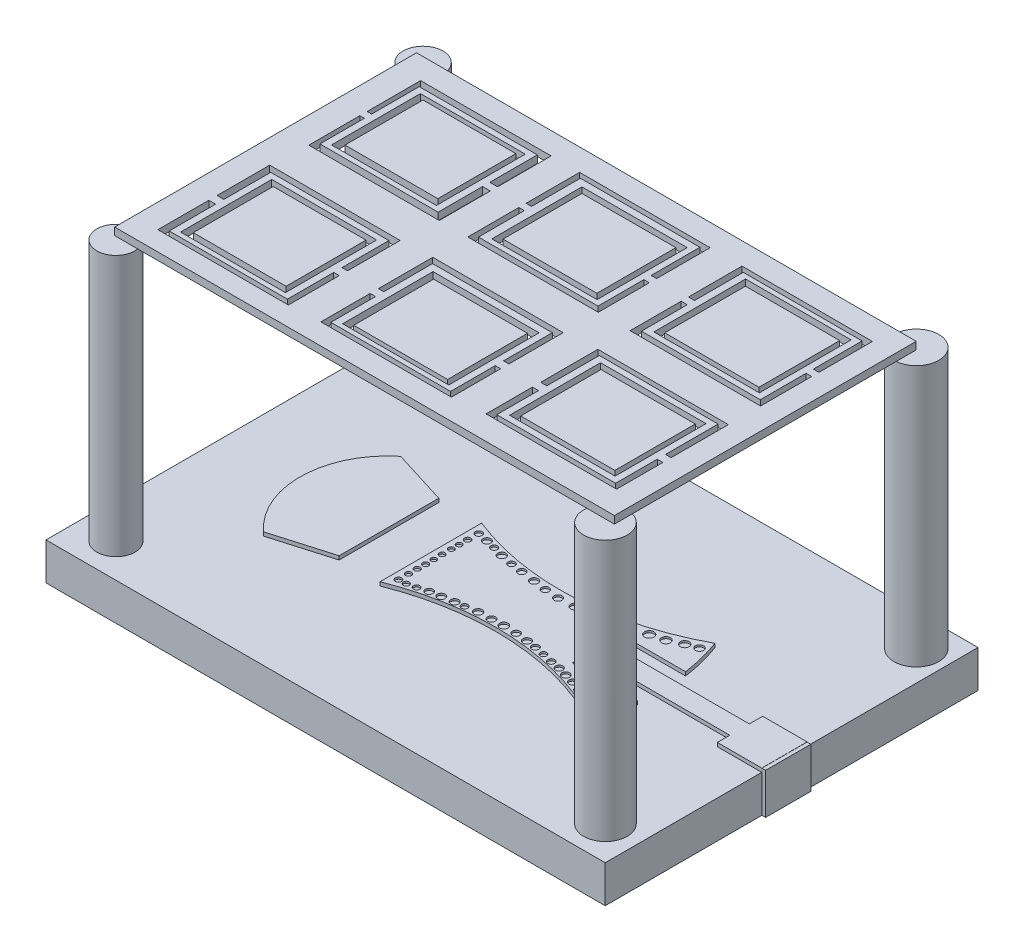
from build123d import *

# Parameters (mm, degrees)
SKETCH1_W           = 15
SKETCH1_H           = 10
BOSS_EXTRUDE1_DEPTH = 1
BOSS_EXTRUDE3_DEPTH = 0.1
SKETCH4_R           = 0.08404807
SKETCH4_R_2         = 0.078648597
SKETCH4_R_3         = 0.079112573
SKETCH4_R_4         = 0.079168928
SKETCH4_R_5         = 0.073492336
SKETCH4_R_6         = 0.076907287
SKETCH4_R_7         = 0.076143431
SKETCH4_R_8         = 0.075473783
SKETCH4_R_9         = 0.081679899
SKETCH4_R_10        = 0.091446078
SKETCH4_R_11        = 0.080118839
SKETCH4_R_12        = 0.08382722
SKETCH4_R_13        = 0.101692564
SKETCH4_R_14        = 0.104017769
SKETCH4_R_15        = 0.104305519
SKETCH4_R_16        = 0.087623359
SKETCH4_R_17        = 0.109373187
SKETCH4_R_18        = 0.103421713
SKETCH4_R_19        = 0.112137735
SKETCH4_R_20        = 0.099980842
SKETCH4_R_21        = 0.106432835
SKETCH4_R_22        = 0.095496829
SKETCH4_R_23        = 0.083167495
SKETCH4_R_24        = 0.091862706
SKETCH4_R_25        = 0.099164907
SKETCH4_R_26        = 0.096133792
SKETCH4_R_27        = 0.107488504
SKETCH4_R_28        = 0.108039655
SKETCH4_R_29        = 0.11284557
SKETCH4_R_30        = 0.105833191
SKETCH4_R_31        = 0.087500941
SKETCH4_R_32        = 0.108184079
SKETCH4_R_33        = 0.091887578
SKETCH4_R_34        = 0.101590536
SKETCH4_R_35        = 0.10874326
SKETCH4_R_36        = 0.099896252
SKETCH4_R_37        = 0.105411216
SKETCH4_R_38        = 0.110092368
SKETCH4_R_39        = 0.111538179
SKETCH4_R_40        = 0.119518934
SKETCH4_R_41        = 0.117282428
SKETCH4_R_42        = 0.124998957
SKETCH4_R_43        = 0.119568335
SKETCH4_R_44        = 0.117616461
SKETCH4_R_45        = 0.109204459
SKETCH4_R_46        = 0.113389559
SKETCH4_R_47        = 0.103967849
CUT_EXTRUDE1_DEPTH  = 0.05
SKETCH7_R           = 0.511988864
SKETCH7_R_2         = 0.53656798
SKETCH7_R_3         = 0.584547728
SKETCH7_R_4         = 0.601410947
BOSS_EXTRUDE4_DEPTH = 7
SKETCH8_W           = 13.404868806
SKETCH8_H           = 8.095482793
BOSS_EXTRUDE5_DEPTH = 0.2
SKETCH9_W           = 2.813790515
SKETCH9_H           = 2.446731184
SKETCH9_W_2         = 2.489913923
SKETCH9_H_2         = 2.143373666
SKETCH9_H_3         = 2.384007885
SKETCH9_H_4         = 2.092857043
SKETCH9_W_3         = 2.845584972
SKETCH9_H_5         = 2.424945468
SKETCH9_W_4         = 2.517381772
SKETCH9_W_5         = 2.822228556
SKETCH9_H_6         = 2.417634942
SKETCH9_H_7         = 2.11773717
SKETCH9_W_6         = 2.830214289
SKETCH9_H_8         = 2.440413026
SKETCH9_W_7         = 2.527654553
SKETCH9_H_9         = 2.157221543
SKETCH9_H_10        = 2.460253307
SKETCH9_H_11        = 2.166211349
CUT_EXTRUDE4_DEPTH  = 2
SKETCH11_W          = 1.211385537
SKETCH11_H          = 1.095339331
BOSS_EXTRUDE6_DEPTH = 0.1


with BuildPart() as part:
    # Sketch1 → Boss-Extrude1 (new body)
    with BuildSketch(Plane(origin=(0, 0, 0), x_dir=(1, 0, 0), z_dir=(0, 1, 0))):
        with Locations((-3.087083516, -10.30646302)):
            Rectangle(SKETCH1_W, SKETCH1_H)
    extrude(amount=BOSS_EXTRUDE1_DEPTH)

    # Sketch2 → Boss-Extrude3 (add)
    with BuildSketch(Plane(origin=(0, 1, 0), x_dir=(1, 0, 0), z_dir=(0, 1, 0))):
        with BuildLine():
            Line((-7.754263874, -12.300690078), (-6.187338637, -11.842809111))
            Line((-6.187338637, -11.842809111), (-6.187338637, -9.170838767))
            Line((-6.187338637, -9.170838767), (-7.671339357, -8.708437744))
            ThreePointArc((-7.671339357, -8.708437744), (-8.543841662, -10.48537996), (-7.754263874, -12.300690078))
        make_face()
        with BuildLine():
            Line((-5.034800823, -9.173433417), (-5.034800823, -11.898013395))
            ThreePointArc((-5.034800823, -11.898013395), (-1.990708873, -11.415844317), (0.969425609, -12.27409059))
            ThreePointArc((0.969425609, -12.27409059), (1.104540684, -11.745809691), (1.185652096, -11.206590133))
            Line((1.185652096, -11.206590133), (-0.573658049, -11.206590133))
            Line((-0.573658049, -11.206590133), (-0.573658049, -10.773444218))
            Line((-0.573658049, -10.773444218), (3.221463254, -10.773444218))
            Line((3.221463254, -10.773444218), (3.221463254, -11.107047597))
            Line((3.221463254, -11.107047597), (4.412916484, -11.107047597))
            Line((4.412916484, -11.107047597), (4.412916484, -9.890890727))
            Line((4.412916484, -9.890890727), (3.221463254, -9.890890727))
            Line((3.221463254, -9.890890727), (3.221463254, -10.248768016))
            Line((3.221463254, -10.248768016), (-0.573658049, -10.248768016))
            Line((-0.573658049, -10.248768016), (-0.573658049, -9.890890727))
            Line((-0.573658049, -9.890890727), (1.154743997, -9.890890727))
            ThreePointArc((1.154743997, -9.890890727), (1.048589239, -9.35681973), (0.889152381, -8.836165764))
            ThreePointArc((0.889152381, -8.836165764), (-2.035287154, -9.66412112), (-5.034800823, -9.173433417))
        make_face()
    extrude(amount=BOSS_EXTRUDE3_DEPTH)

    # Sketch4 → Cut-Extrude1 (cut)
    with BuildSketch(Plane(origin=(0, 1.1, 0), x_dir=(1, 0, 0), z_dir=(0, 1, 0))):
        with Locations((-4.83666706, -11.602759609)):
            Circle(SKETCH4_R)
        with Locations((-4.83666706, -11.332342919)):
            Circle(SKETCH4_R_2)
        with Locations((-4.83666706, -11.100994462)):
            Circle(SKETCH4_R_3)
        with Locations((-4.830877887, -10.880983654)):
            Circle(SKETCH4_R_4)
        with Locations((-4.830877887, -10.660487196)):
            Circle(SKETCH4_R_5)
        with Locations((-4.83666706, -10.430279322)):
            Circle(SKETCH4_R_6)
        with Locations((-4.83666706, -10.18220917)):
            Circle(SKETCH4_R_7)
        with Locations((-4.836673, -9.974192205)):
            Circle(SKETCH4_R_8)
        with Locations((-4.83666706, -9.747325915)):
            Circle(SKETCH4_R_9)
        with Locations((-4.830877887, -9.455715111)):
            Circle(SKETCH4_R_10)
        with Locations((-4.637829339, -11.59143287)):
            Circle(SKETCH4_R_11)
        with Locations((-4.412213651, -11.539756692)):
            Circle(SKETCH4_R_12)
        with Locations((-4.15161441, -11.465001291)):
            Circle(SKETCH4_R_13)
        with Locations((-3.873304564, -11.416770173)):
            Circle(SKETCH4_R_14)
        with Locations((-3.568146448, -11.363924053)):
            Circle(SKETCH4_R_15)
        with Locations((-3.3301854, -11.334842991)):
            Circle(SKETCH4_R_16)
        with Locations((-3.01928832, -11.284947396)):
            Circle(SKETCH4_R_17)
        with Locations((-2.675126152, -11.269056066)):
            Circle(SKETCH4_R_18)
        with Locations((-2.357549224, -11.25637604)):
            Circle(SKETCH4_R_19)
        with Locations((-2.012003425, -11.269056066)):
            Circle(SKETCH4_R_20)
        with Locations((-1.689895211, -11.302778087)):
            Circle(SKETCH4_R_21)
        with Locations((-1.430792738, -11.334842991)):
            Circle(SKETCH4_R_22)
        with Locations((-1.160837501, -11.388654237)):
            Circle(SKETCH4_R_23)
        with Locations((-0.886084035, -11.455150599)):
            Circle(SKETCH4_R_24)
        with Locations((-0.627031556, -11.502330935)):
            Circle(SKETCH4_R_25)
        with Locations((-0.123988492, -11.646759979)):
            Circle(SKETCH4_R_26)
        with Locations((0.151484031, -11.740485043)):
            Circle(SKETCH4_R_27)
        with Locations((0.441194821, -11.875172635)):
            Circle(SKETCH4_R_28)
        with Locations((0.74912936, -12.010578122)):
            Circle(SKETCH4_R_29)
        with Locations((-4.549563888, -9.516257382)):
            Circle(SKETCH4_R_30)
        with Locations((-4.295883928, -9.576097395)):
            Circle(SKETCH4_R_31)
        with Locations((-4.012832927, -9.653574387)):
            Circle(SKETCH4_R_32)
        with Locations((-3.686948741, -9.72091873)):
            Circle(SKETCH4_R_33)
        with Locations((-3.372184134, -9.761383372)):
            Circle(SKETCH4_R_34)
        with Locations((-2.98678451, -9.812806308)):
            Circle(SKETCH4_R_35)
        with Locations((-2.636244668, -9.862973909)):
            Circle(SKETCH4_R_36)
        with Locations((-2.269336348, -9.890223739)):
            Circle(SKETCH4_R_37)
        with Locations((-1.847162344, -9.862973909)):
            Circle(SKETCH4_R_38)
        with Locations((-1.5343685, -9.842942516)):
            Circle(SKETCH4_R_39)
        with Locations((-0.951868155, -9.737895757)):
            Circle(SKETCH4_R_40)
        with Locations((-0.608529302, -9.663598336)):
            Circle(SKETCH4_R_41)
        with Locations((-0.20121135, -9.511532888)):
            Circle(SKETCH4_R_42)
        with Locations((0.158415834, -9.421234702)):
            Circle(SKETCH4_R_43)
        with Locations((0.503004379, -9.262251263)):
            Circle(SKETCH4_R_44)
        with Locations((0.791211489, -9.154940305)):
            Circle(SKETCH4_R_45)
        with Locations((-1.255509111, -9.80036179)):
            Circle(SKETCH4_R_46)
        with Locations((-0.376470274, -11.575235122)):
            Circle(SKETCH4_R_47)
    extrude(amount=-CUT_EXTRUDE1_DEPTH, mode=Mode.SUBTRACT)

    # Sketch7 → Boss-Extrude4 (add)
    with BuildSketch(Plane(origin=(0, 1, 0), x_dir=(1, 0, 0), z_dir=(0, 1, 0))):
        with Locations((-9.619469301, -14.398463654)):
            Circle(SKETCH7_R)
        with Locations((-9.619469301, -6.161151994)):
            Circle(SKETCH7_R_2)
        with Locations((3.511550626, -14.398463654)):
            Circle(SKETCH7_R_3)
        with Locations((3.613841518, -6.161151994)):
            Circle(SKETCH7_R_4)
    extrude(amount=BOSS_EXTRUDE4_DEPTH)

    # Sketch8 → Boss-Extrude5 (add)
    with BuildSketch(Plane(origin=(0, 8, 0), x_dir=(1, 0, 0), z_dir=(0, 1, 0))):
        with Locations((-3.031235406, -10.269605928)):
            Rectangle(SKETCH8_W, SKETCH8_H)
    extrude(amount=BOSS_EXTRUDE5_DEPTH)

    # Sketch9 → Cut-Extrude4 (cut)
    # profile 1 of 18: a face of its own
    with BuildSketch(Plane(origin=(0, 8.2, 0), x_dir=(1, 0, 0), z_dir=(0, 1, 0))):
        Polygon((-9.092726311, -12.433458539), (-8.911094854, -12.433458539), (-8.911094854, -13.676967395), (-5.741578039, -13.676967395), (-5.741578039, -12.433458539), (-5.592726311, -12.433458539), (-5.592726311, -13.800467421), (-9.092726311, -13.800467421), align=None)
    # profile 2 of 18: a face of its own
    with BuildSketch(Plane(origin=(0, 8.2, 0), x_dir=(1, 0, 0), z_dir=(0, 1, 0))):
        Polygon((-9.092726311, -10.800467421), (-5.592726311, -10.800467421), (-5.592726311, -12.211472668), (-5.741578039, -12.211472668), (-5.741578039, -10.953240708), (-8.911094854, -10.953240708), (-8.911094854, -12.211472668), (-9.092726311, -12.211472668), align=None)
    # profile 3 of 18: a face of its own
    with BuildSketch(Plane(origin=(0, 8.2, 0), x_dir=(1, 0, 0), z_dir=(0, 1, 0))):
        Polygon((-4.764987028, -13.754660274), (-1.264987028, -13.754660274), (-1.264987028, -12.433458539), (-1.409938788, -12.433458539), (-1.409938788, -13.631409206), (-4.620965234, -13.631409206), (-4.620965234, -12.433458539), (-4.764987028, -12.433458539), align=None)
    # profile 4 of 18: a face of its own
    with BuildSketch(Plane(origin=(0, 8.2, 0), x_dir=(1, 0, 0), z_dir=(0, 1, 0))):
        Polygon((-4.764987028, -10.754660274), (-1.264987028, -10.754660274), (-1.264987028, -12.211472668), (-1.409938788, -12.211472668), (-1.409938788, -10.903179136), (-4.620965234, -10.903179136), (-4.620965234, -12.211472668), (-4.764987028, -12.211472668), align=None)
    # profile 5 of 18: a face of its own
    with BuildSketch(Plane(origin=(0, 8.2, 0), x_dir=(1, 0, 0), z_dir=(0, 1, 0))):
        Polygon((-0.412753268, -13.676967395), (3.087246732, -13.676967395), (3.087246732, -12.433458539), (2.936757236, -12.433458539), (2.936757236, -13.551722258), (-0.249462049, -13.551722258), (-0.249462049, -12.433458539), (-0.412753268, -12.433458539), align=None)
    # profile 6 of 18: a face of its own
    with BuildSketch(Plane(origin=(0, 8.2, 0), x_dir=(1, 0, 0), z_dir=(0, 1, 0))):
        Polygon((-0.412753268, -10.676967395), (3.087246732, -10.676967395), (3.087246732, -12.211472668), (2.936757236, -12.211472668), (2.936757236, -10.800467421), (-0.249462049, -10.800467421), (-0.249462049, -12.211472668), (-0.412753268, -12.211472668), align=None)
    # profile 7 of 18: a face of its own
    with BuildSketch(Plane(origin=(0, 8.2, 0), x_dir=(1, 0, 0), z_dir=(0, 1, 0))):
        Polygon((-9.031995174, -9.812574053), (-5.531995174, -9.812574053), (-5.531995174, -8.442443145), (-5.741578039, -8.442443145), (-5.741578039, -9.633955587), (-8.911094854, -9.633955587), (-8.911094854, -8.442443145), (-9.031995174, -8.442443145), align=None)
    # profile 8 of 18: a face of its own
    with BuildSketch(Plane(origin=(0, 8.2, 0), x_dir=(1, 0, 0), z_dir=(0, 1, 0))):
        Polygon((-9.031995174, -6.812574053), (-5.531995174, -6.812574053), (-5.531995174, -8.24725243), (-5.741578039, -8.24725243), (-5.741578039, -6.971834174), (-8.911094854, -6.971834174), (-8.911094854, -8.24725243), (-9.031995174, -8.24725243), align=None)
    # profile 9 of 18: a face of its own
    with BuildSketch(Plane(origin=(0, 8.2, 0), x_dir=(1, 0, 0), z_dir=(0, 1, 0))):
        Polygon((-4.767252135, -9.812147582), (-1.267252135, -9.812147582), (-1.267252135, -8.442443145), (-1.414166168, -8.442443145), (-1.414166168, -9.67119567), (-4.620965234, -9.67119567), (-4.620965234, -8.442443145), (-4.767252135, -8.442443145), align=None)
    # profile 10 of 18: a face of its own
    with BuildSketch(Plane(origin=(0, 8.2, 0), x_dir=(1, 0, 0), z_dir=(0, 1, 0))):
        Polygon((-4.767252135, -6.812147582), (-1.267252135, -6.812147582), (-1.267252135, -8.24725243), (-1.414166168, -8.24725243), (-1.414166168, -6.938543043), (-4.620965234, -6.938543043), (-4.620965234, -8.24725243), (-4.767252135, -8.24725243), align=None)
    # profile 11 of 18: a face of its own
    with BuildSketch(Plane(origin=(0, 8.2, 0), x_dir=(1, 0, 0), z_dir=(0, 1, 0))):
        Polygon((-0.412753268, -9.812485404), (3.087246732, -9.812485404), (3.087246732, -8.442443145), (2.936757236, -8.442443145), (2.936757236, -9.67119567), (-0.249462049, -9.67119567), (-0.249462049, -8.442443145), (-0.412753268, -8.442443145), align=None)
    # profile 12 of 18: a face of its own
    with BuildSketch(Plane(origin=(0, 8.2, 0), x_dir=(1, 0, 0), z_dir=(0, 1, 0))):
        Polygon((-0.412753268, -6.812485404), (3.087246732, -6.812485404), (3.087246732, -8.24725243), (2.936757236, -8.24725243), (2.936757236, -6.938543043), (-0.249462049, -6.938543043), (-0.249462049, -8.24725243), (-0.412753268, -8.24725243), align=None)
    # profile 13 of 18: a face of its own
    with BuildSketch(Plane(origin=(0, 8.2, 0), x_dir=(1, 0, 0), z_dir=(0, 1, 0))):
        with Locations((-7.326327938, -12.328356666)):
            Rectangle(SKETCH9_W, SKETCH9_H)
        with Locations((-7.304062072, -12.321966901)):
            Rectangle(SKETCH9_W_2, SKETCH9_H_2, mode=Mode.SUBTRACT)
    # profile 14 of 18: a face of its own
    with BuildSketch(Plane(origin=(0, 8.2, 0), x_dir=(1, 0, 0), z_dir=(0, 1, 0))):
        with Locations((-7.326327938, -8.309298967)):
            Rectangle(SKETCH9_W, SKETCH9_H_3)
        with Locations((-7.304062072, -8.277736819)):
            Rectangle(SKETCH9_W_2, SKETCH9_H_4, mode=Mode.SUBTRACT)
    # profile 15 of 18: a face of its own
    with BuildSketch(Plane(origin=(0, 8.2, 0), x_dir=(1, 0, 0), z_dir=(0, 1, 0))):
        with Locations((-3.006260505, -12.295004745)):
            Rectangle(SKETCH9_W_3, SKETCH9_H_5)
        with Locations((-2.986712005, -12.321966901)):
            Rectangle(SKETCH9_W_4, SKETCH9_H_2, mode=Mode.SUBTRACT)
    # profile 16 of 18: a face of its own
    with BuildSketch(Plane(origin=(0, 8.2, 0), x_dir=(1, 0, 0), z_dir=(0, 1, 0))):
        with Locations((-2.988948358, -8.326112495)):
            Rectangle(SKETCH9_W_5, SKETCH9_H_6)
        with Locations((-2.986712005, -8.329831183)):
            Rectangle(SKETCH9_W_4, SKETCH9_H_7, mode=Mode.SUBTRACT)
    # profile 17 of 18: a face of its own
    with BuildSketch(Plane(origin=(0, 8.2, 0), x_dir=(1, 0, 0), z_dir=(0, 1, 0))):
        with Locations((1.349610685, -12.173447221)):
            Rectangle(SKETCH9_W_6, SKETCH9_H_8)
        with Locations((1.364423031, -12.183601846)):
            Rectangle(SKETCH9_W_7, SKETCH9_H_9, mode=Mode.SUBTRACT)
    # profile 18 of 18: a face of its own
    with BuildSketch(Plane(origin=(0, 8.2, 0), x_dir=(1, 0, 0), z_dir=(0, 1, 0))):
        with Locations((1.349610685, -8.292703304)):
            Rectangle(SKETCH9_W_6, SKETCH9_H_10)
        with Locations((1.364423031, -8.314413972)):
            Rectangle(SKETCH9_W_7, SKETCH9_H_11, mode=Mode.SUBTRACT)
    extrude(amount=-CUT_EXTRUDE4_DEPTH, mode=Mode.SUBTRACT)


with BuildPart() as cut_extrude4_piece_1:
    # of the separate pieces the step leaves, piece 1, a body of its own (cut_extrude4_pieces)
    add(part.part.solids().sort_by_distance((-10.587083516, 0, 5.30646302))[0])

    # Sketch11 → Boss-Extrude6 (add)
    with BuildSketch(Plane(origin=(4.412916484, 0, 0), x_dir=(0, 0, -1), z_dir=(1, 0, 0))):
        with Locations((-10.498424961, 0.547669666)):
            Rectangle(SKETCH11_W, SKETCH11_H)
    extrude(amount=BOSS_EXTRUDE6_DEPTH)


with BuildPart() as cut_extrude4_piece_2:
    # of the separate pieces the step leaves, piece 2, a body of its own (cut_extrude4_pieces)
    add(part.part.solids().sort_by_distance((2.628250307, 8, 7.231308297))[0])


with BuildPart() as cut_extrude4_piece_3:
    # of the separate pieces the step leaves, piece 3, a body of its own (cut_extrude4_pieces)
    add(part.part.solids().sort_by_distance((2.628250307, 8, 11.104991074))[0])


with BuildPart() as cut_extrude4_piece_4:
    # of the separate pieces the step leaves, piece 4, a body of its own (cut_extrude4_pieces)
    add(part.part.solids().sort_by_distance((-1.728021119, 8, 11.250280068))[0])


with BuildPart() as cut_extrude4_piece_5:
    # of the separate pieces the step leaves, piece 5, a body of its own (cut_extrude4_pieces)
    add(part.part.solids().sort_by_distance((-6.05910511, 8, 11.250280068))[0])


with BuildPart() as cut_extrude4_piece_6:
    # of the separate pieces the step leaves, piece 6, a body of its own (cut_extrude4_pieces)
    add(part.part.solids().sort_by_distance((-1.728021119, 8, 7.270962598))[0])


with BuildPart() as cut_extrude4_piece_7:
    # of the separate pieces the step leaves, piece 7, a body of its own (cut_extrude4_pieces)
    add(part.part.solids().sort_by_distance((-6.05910511, 8, 7.231308297))[0])


solid = Compound([cut_extrude4_piece_1.part, cut_extrude4_piece_2.part, cut_extrude4_piece_3.part, cut_extrude4_piece_4.part, cut_extrude4_piece_5.part, cut_extrude4_piece_6.part, cut_extrude4_piece_7.part])
